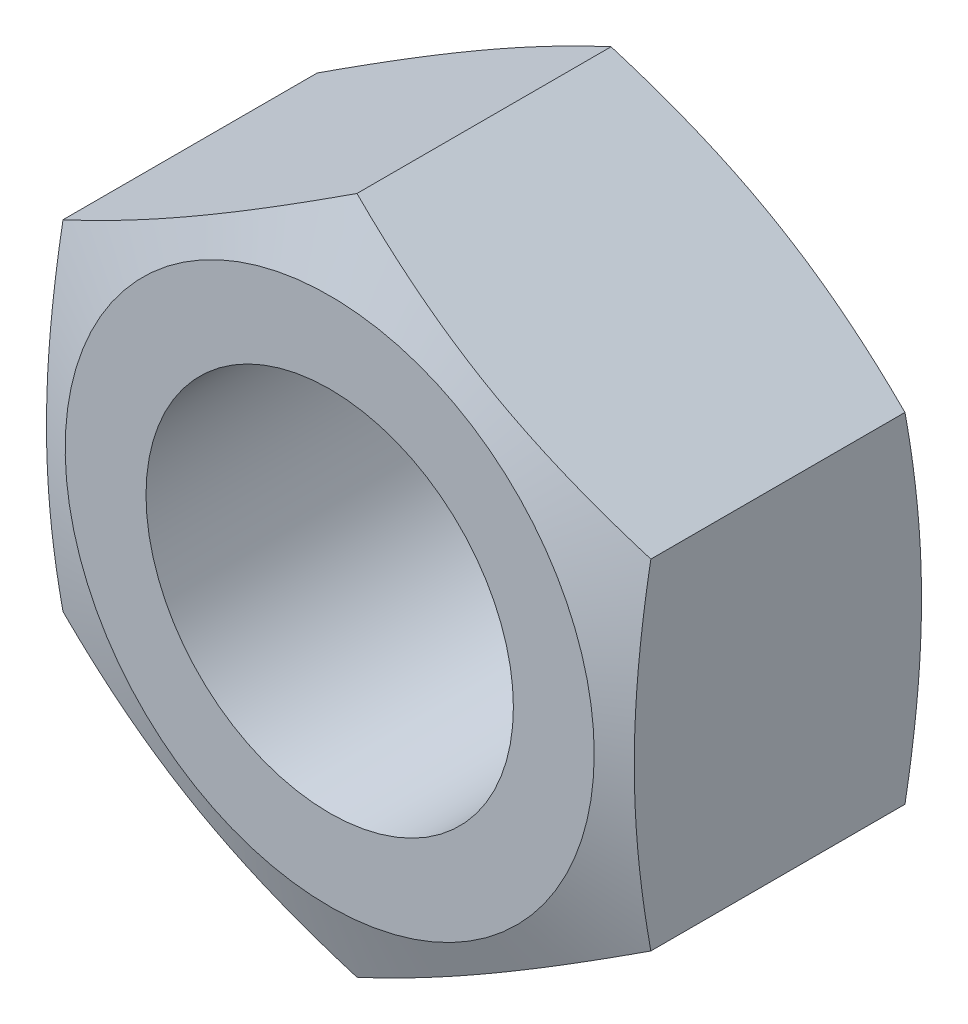
from build123d import *

# Parameters (mm, degrees)
EXTRUDE_1_DEPTH     = 8.4
SKETCH_5_R          = 5
CUT_EXTRUDE_1_DEPTH = 15.828800806


with BuildPart() as part:
    # 草图1 → 凸台-拉伸1 (new body)
    with BuildSketch(Plane.XY):
        Polygon((0, 9.237604307), (-8, 4.618802154), (-8, -4.618802154), (0, -9.237604307), (8, -4.618802154), (8, 4.618802154), align=None)
    extrude(amount=EXTRUDE_1_DEPTH)

    # 草图4 → 切除-旋转1 (revolve, cut)
    with BuildSketch(Plane(origin=(0, 0, 0), x_dir=(0, 0, -1), z_dir=(1, 0, 0))):
        Polygon((-8.4, -7.2), (-7.658372683, -9.237604307), (-8.4, -9.237604307), align=None)
    cut_revolve_1 = revolve(axis=Axis((0, 0, 8.4), (0, 0, -1)), mode=Mode.SUBTRACT)

    # 镜向1: 切除-旋转1 across plane
    add(cut_revolve_1.mirror(Plane.XY.offset(4.2)), mode=Mode.SUBTRACT)

    # 草图5 → 切除-拉伸1 (cut, through all)
    with BuildSketch(Plane.XY.offset(8.4)):
        Circle(SKETCH_5_R)
    extrude(amount=-CUT_EXTRUDE_1_DEPTH, mode=Mode.SUBTRACT)


solid = part.part
